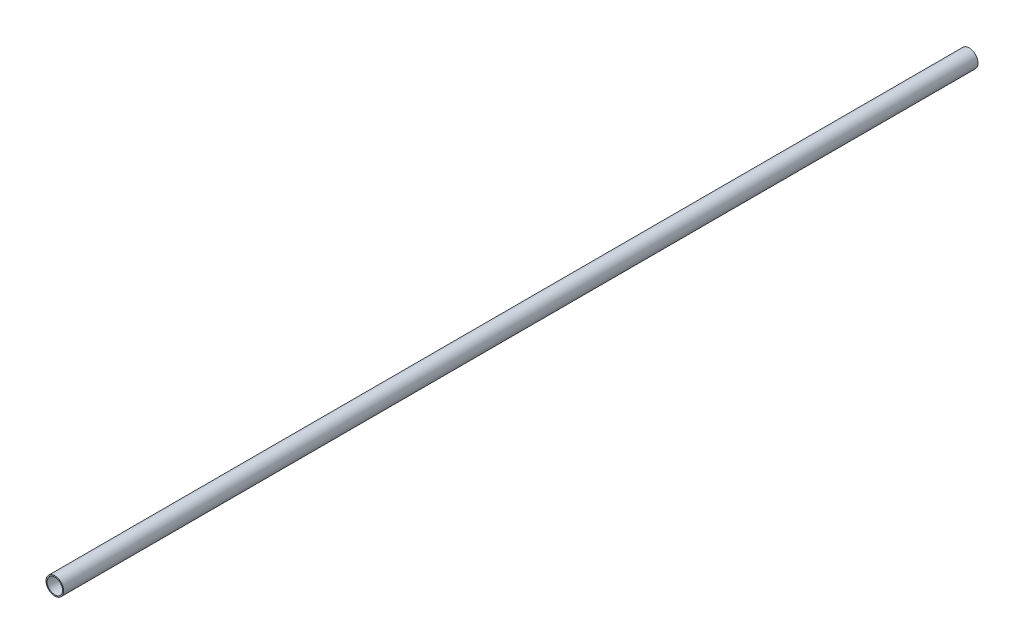
from build123d import *

# Parameters (mm, degrees)
SKETCH2_R           = 24.125
SKETCH2_R_2         = 21.075
BOSS_EXTRUDE1_DEPTH = 2500


with BuildPart() as part:
    # Sketch2 → Boss-Extrude1 (new body)
    with BuildSketch(Plane.XY):
        with Locations((2449.72011288, -5187.007415734)):
            Circle(SKETCH2_R)
        with Locations((2449.72011288, -5187.007415734)):
            Circle(SKETCH2_R_2, mode=Mode.SUBTRACT)
    extrude(amount=BOSS_EXTRUDE1_DEPTH)


solid = part.part
